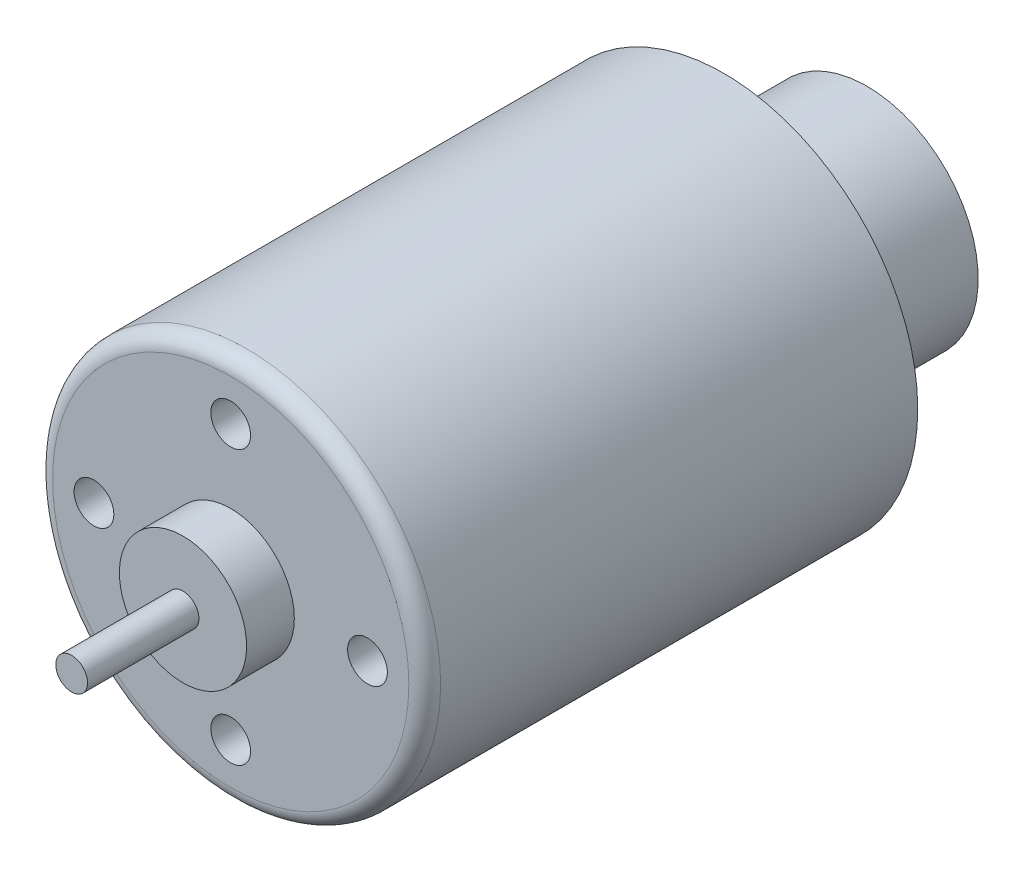
from build123d import *

# Parameters (mm, degrees)
ESBO_O1_R                                   = 12.2
RESSALTO_EXTRUS_O1_DEPTH                    = 31
BROCA_DE_ROSQUEAR_PARA_TARRAXA_DE_M31_D     = 2.5
BROCA_DE_ROSQUEAR_PARA_TARRAXA_DE_M31_DEPTH = 3
BROCA_DE_ROSQUEAR_PARA_TARRAXA_DE_M31_TIP   = 0.751075774
ESBO_O5_R                                   = 4
RESSALTO_EXTRUS_O2_DEPTH                    = 3
ESBO_O6_R                                   = 1
RESSALTO_EXTRUS_O3_DEPTH                    = 7
ESBO_O7_R                                   = 7
RESSALTO_EXTRUS_O4_DEPTH                    = 9
FILETE1_R                                   = 1


with BuildPart() as part:
    # Esboço1 → Ressalto-extrusão1 (new body)
    with BuildSketch(Plane.XY):
        Circle(ESBO_O1_R)
    extrude(amount=RESSALTO_EXTRUS_O1_DEPTH)

    # Broca de rosquear para tarraxa de M31
    with Locations(Plane(origin=(-8.6, 0, 31), x_dir=(1, 0, 0), z_dir=(0, 0, 1))):
        with Locations((0, 0), (8.6, 8.6), (17.2, 0), (8.6, -8.6)):
            Hole(BROCA_DE_ROSQUEAR_PARA_TARRAXA_DE_M31_D / 2, depth=BROCA_DE_ROSQUEAR_PARA_TARRAXA_DE_M31_DEPTH)
            with Locations((0, 0, -(BROCA_DE_ROSQUEAR_PARA_TARRAXA_DE_M31_DEPTH + BROCA_DE_ROSQUEAR_PARA_TARRAXA_DE_M31_TIP / 2))):  # 118° drill point
                Cone(0, BROCA_DE_ROSQUEAR_PARA_TARRAXA_DE_M31_D / 2, BROCA_DE_ROSQUEAR_PARA_TARRAXA_DE_M31_TIP, mode=Mode.SUBTRACT)

    # Esboço5 → Ressalto-extrusão2 (add)
    with BuildSketch(Plane.XY.offset(31)):
        Circle(ESBO_O5_R)
    extrude(amount=RESSALTO_EXTRUS_O2_DEPTH)

    # Esboço6 → Ressalto-extrusão3 (add)
    with BuildSketch(Plane.XY.offset(34)):
        Circle(ESBO_O6_R)
    extrude(amount=RESSALTO_EXTRUS_O3_DEPTH)

    # Esboço7 → Ressalto-extrusão4 (add)
    with BuildSketch(Plane(origin=(0, 0, 0), x_dir=(-1, 0, 0), z_dir=(0, 0, -1))):
        Circle(ESBO_O7_R)
    extrude(amount=RESSALTO_EXTRUS_O4_DEPTH)

    # Filete1
    filete1_edges = [part.edges().sort_by_distance(p)[0] for p in [
        (-12.2, 0, 31),
    ]]
    fillet(filete1_edges, radius=FILETE1_R)


solid = part.part
